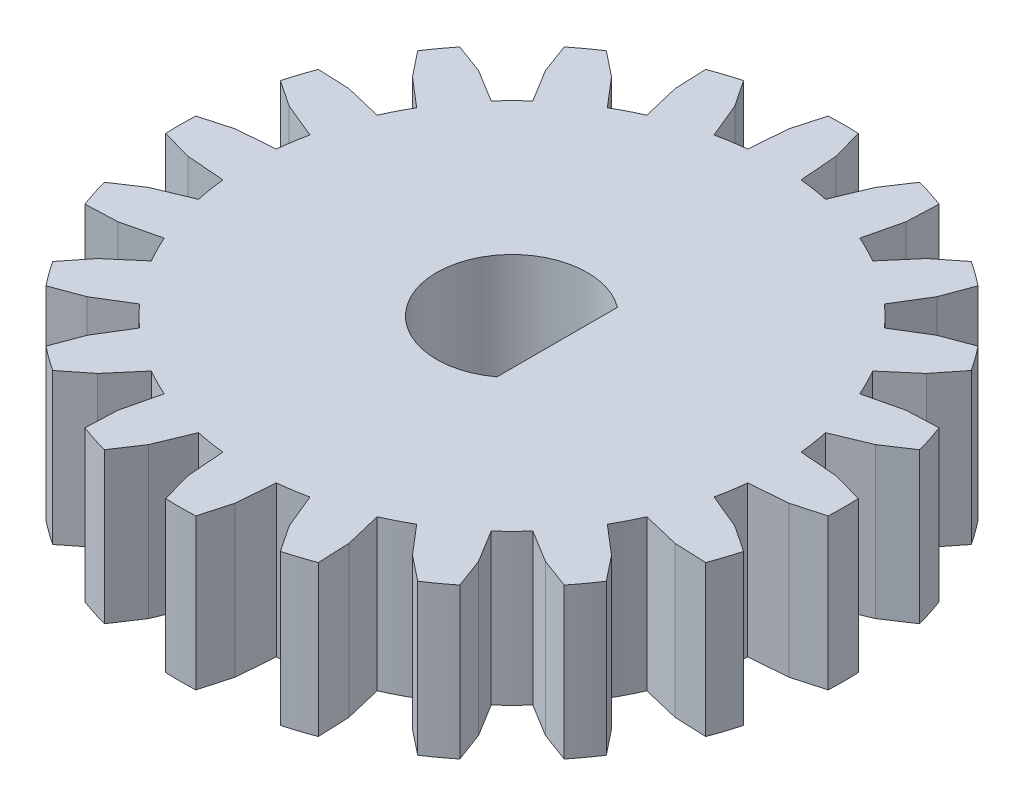
from build123d import *

# Parameters (mm, degrees)
BOSS_EXTRUDE1_DEPTH = 5


with BuildPart() as part:
    # Sketch1 → Boss-Extrude1 (new body)
    with BuildSketch(Plane(origin=(0, 0, 0), x_dir=(1, 0, 0), z_dir=(0, 1, 0))):
        with BuildLine():
            Line((0.885, 8.705129235), (0.785, 9.969141137))
            Line((0.785, 9.969141137), (0.5, 10.988630488))
            ThreePointArc((0.5, 10.988630488), (0, 11), (-0.5, 10.988630488))
            Line((-0.5, 10.988630488), (-0.785, 9.969141137))
            Line((-0.785, 9.969141137), (-0.885, 8.705129235))
            ThreePointArc((-0.885, 8.705129235), (-1.368801569, 8.64227298), (-1.848347855, 8.552549924))
            Line((-1.848347855, 8.552549924), (-2.334054665, 9.72379498))
            Line((-2.334054665, 9.72379498), (-2.920145308, 10.605317128))
            ThreePointArc((-2.920145308, 10.605317128), (-3.399186938, 10.461621679), (-3.871201824, 10.296300134))
            Line((-3.871201824, 10.296300134), (-3.827213396, 9.238638299))
            Line((-3.827213396, 9.238638299), (-3.531717889, 8.005589844))
            ThreePointArc((-3.531717889, 8.005589844), (-3.972416873, 7.796307087), (-4.400766544, 7.562787438))
            Line((-4.400766544, 7.562787438), (-5.224635797, 8.526616022))
            Line((-5.224635797, 8.526616022), (-6.054446447, 9.183881436))
            ThreePointArc((-6.054446447, 9.183881436), (-6.465637775, 8.899186938), (-6.863463441, 8.596096183))
            Line((-6.863463441, 8.596096183), (-6.494792479, 7.603793176))
            Line((-6.494792479, 7.603793176), (-5.832726624, 6.522407541))
            ThreePointArc((-5.832726624, 6.522407541), (-6.187184335, 6.187184335), (-6.522407541, 5.832726624))
            Line((-6.522407541, 5.832726624), (-7.603793176, 6.494792479))
            Line((-7.603793176, 6.494792479), (-8.596096183, 6.863463441))
            ThreePointArc((-8.596096183, 6.863463441), (-8.899186938, 6.465637775), (-9.183881436, 6.054446447))
            Line((-9.183881436, 6.054446447), (-8.526616022, 5.224635797))
            Line((-8.526616022, 5.224635797), (-7.562787438, 4.400766544))
            ThreePointArc((-7.562787438, 4.400766544), (-7.796307087, 3.972416873), (-8.005589844, 3.531717889))
            Line((-8.005589844, 3.531717889), (-9.238638299, 3.827213396))
            Line((-9.238638299, 3.827213396), (-10.296300134, 3.871201824))
            ThreePointArc((-10.296300134, 3.871201824), (-10.461621679, 3.399186938), (-10.605317128, 2.920145308))
            Line((-10.605317128, 2.920145308), (-9.72379498, 2.334054665))
            Line((-9.72379498, 2.334054665), (-8.552549924, 1.848347855))
            ThreePointArc((-8.552549924, 1.848347855), (-8.64227298, 1.368801569), (-8.705129235, 0.885))
            Line((-8.705129235, 0.885), (-9.969141137, 0.785))
            Line((-9.969141137, 0.785), (-10.988630488, 0.5))
            ThreePointArc((-10.988630488, 0.5), (-11, 0), (-10.988630488, -0.5))
            Line((-10.988630488, -0.5), (-9.969141137, -0.785))
            Line((-9.969141137, -0.785), (-8.705129235, -0.885))
            ThreePointArc((-8.705129235, -0.885), (-8.64227298, -1.368801569), (-8.552549924, -1.848347855))
            Line((-8.552549924, -1.848347855), (-9.72379498, -2.334054665))
            Line((-9.72379498, -2.334054665), (-10.605317128, -2.920145308))
            ThreePointArc((-10.605317128, -2.920145308), (-10.461621679, -3.399186938), (-10.296300134, -3.871201824))
            Line((-10.296300134, -3.871201824), (-9.238638299, -3.827213396))
            Line((-9.238638299, -3.827213396), (-8.005589844, -3.531717889))
            ThreePointArc((-8.005589844, -3.531717889), (-7.796307087, -3.972416873), (-7.562787438, -4.400766544))
            Line((-7.562787438, -4.400766544), (-8.526616022, -5.224635797))
            Line((-8.526616022, -5.224635797), (-9.183881436, -6.054446447))
            ThreePointArc((-9.183881436, -6.054446447), (-8.899186938, -6.465637775), (-8.596096183, -6.863463441))
            Line((-8.596096183, -6.863463441), (-7.603793176, -6.494792479))
            Line((-7.603793176, -6.494792479), (-6.522407541, -5.832726624))
            ThreePointArc((-6.522407541, -5.832726624), (-6.187184335, -6.187184335), (-5.832726624, -6.522407541))
            Line((-5.832726624, -6.522407541), (-6.494792479, -7.603793176))
            Line((-6.494792479, -7.603793176), (-6.863463441, -8.596096183))
            ThreePointArc((-6.863463441, -8.596096183), (-6.465637775, -8.899186938), (-6.054446447, -9.183881436))
            Line((-6.054446447, -9.183881436), (-5.224635797, -8.526616022))
            Line((-5.224635797, -8.526616022), (-4.400766544, -7.562787438))
            ThreePointArc((-4.400766544, -7.562787438), (-3.972416873, -7.796307087), (-3.531717889, -8.005589844))
            Line((-3.531717889, -8.005589844), (-3.827213396, -9.238638299))
            Line((-3.827213396, -9.238638299), (-3.871201824, -10.296300134))
            ThreePointArc((-3.871201824, -10.296300134), (-3.399186938, -10.461621679), (-2.920145308, -10.605317128))
            Line((-2.920145308, -10.605317128), (-2.334054665, -9.72379498))
            Line((-2.334054665, -9.72379498), (-1.848347855, -8.552549924))
            ThreePointArc((-1.848347855, -8.552549924), (-1.368801569, -8.64227298), (-0.885, -8.705129235))
            Line((-0.885, -8.705129235), (-0.785, -9.969141137))
            Line((-0.785, -9.969141137), (-0.5, -10.988630488))
            ThreePointArc((-0.5, -10.988630488), (0, -11), (0.5, -10.988630488))
            Line((0.5, -10.988630488), (0.785, -9.969141137))
            Line((0.785, -9.969141137), (0.885, -8.705129235))
            ThreePointArc((0.885, -8.705129235), (1.368801569, -8.64227298), (1.848347855, -8.552549924))
            Line((1.848347855, -8.552549924), (2.334054665, -9.72379498))
            Line((2.334054665, -9.72379498), (2.920145308, -10.605317128))
            ThreePointArc((2.920145308, -10.605317128), (3.399186938, -10.461621679), (3.871201824, -10.296300134))
            Line((3.871201824, -10.296300134), (3.827213396, -9.238638299))
            Line((3.827213396, -9.238638299), (3.531717889, -8.005589844))
            ThreePointArc((3.531717889, -8.005589844), (3.972416873, -7.796307087), (4.400766544, -7.562787438))
            Line((4.400766544, -7.562787438), (5.224635797, -8.526616022))
            Line((5.224635797, -8.526616022), (6.054446447, -9.183881436))
            ThreePointArc((6.054446447, -9.183881436), (6.465637775, -8.899186938), (6.863463441, -8.596096183))
            Line((6.863463441, -8.596096183), (6.494792479, -7.603793176))
            Line((6.494792479, -7.603793176), (5.832726624, -6.522407541))
            ThreePointArc((5.832726624, -6.522407541), (6.187184335, -6.187184335), (6.522407541, -5.832726624))
            Line((6.522407541, -5.832726624), (7.603793176, -6.494792479))
            Line((7.603793176, -6.494792479), (8.596096183, -6.863463441))
            ThreePointArc((8.596096183, -6.863463441), (8.899186938, -6.465637775), (9.183881436, -6.054446447))
            Line((9.183881436, -6.054446447), (8.526616022, -5.224635797))
            Line((8.526616022, -5.224635797), (7.562787438, -4.400766544))
            ThreePointArc((7.562787438, -4.400766544), (7.796307087, -3.972416873), (8.005589844, -3.531717889))
            Line((8.005589844, -3.531717889), (9.238638299, -3.827213396))
            Line((9.238638299, -3.827213396), (10.296300134, -3.871201824))
            ThreePointArc((10.296300134, -3.871201824), (10.461621679, -3.399186938), (10.605317128, -2.920145308))
            Line((10.605317128, -2.920145308), (9.72379498, -2.334054665))
            Line((9.72379498, -2.334054665), (8.552549924, -1.848347855))
            ThreePointArc((8.552549924, -1.848347855), (8.64227298, -1.368801569), (8.705129235, -0.885))
            Line((8.705129235, -0.885), (9.969141137, -0.785))
            Line((9.969141137, -0.785), (10.988630488, -0.5))
            ThreePointArc((10.988630488, -0.5), (11, 0), (10.988630488, 0.5))
            Line((10.988630488, 0.5), (9.969141137, 0.785))
            Line((9.969141137, 0.785), (8.705129235, 0.885))
            ThreePointArc((8.705129235, 0.885), (8.64227298, 1.368801569), (8.552549924, 1.848347855))
            Line((8.552549924, 1.848347855), (9.72379498, 2.334054665))
            Line((9.72379498, 2.334054665), (10.605317128, 2.920145308))
            ThreePointArc((10.605317128, 2.920145308), (10.461621679, 3.399186938), (10.296300134, 3.871201824))
            Line((10.296300134, 3.871201824), (9.238638299, 3.827213396))
            Line((9.238638299, 3.827213396), (8.005589844, 3.531717889))
            ThreePointArc((8.005589844, 3.531717889), (7.796307087, 3.972416873), (7.562787438, 4.400766544))
            Line((7.562787438, 4.400766544), (8.526616022, 5.224635797))
            Line((8.526616022, 5.224635797), (9.183881436, 6.054446447))
            ThreePointArc((9.183881436, 6.054446447), (8.899186938, 6.465637775), (8.596096183, 6.863463441))
            Line((8.596096183, 6.863463441), (7.603793176, 6.494792479))
            Line((7.603793176, 6.494792479), (6.522407541, 5.832726624))
            ThreePointArc((6.522407541, 5.832726624), (6.187184335, 6.187184335), (5.832726624, 6.522407541))
            Line((5.832726624, 6.522407541), (6.494792479, 7.603793176))
            Line((6.494792479, 7.603793176), (6.863463441, 8.596096183))
            ThreePointArc((6.863463441, 8.596096183), (6.465637775, 8.899186938), (6.054446447, 9.183881436))
            Line((6.054446447, 9.183881436), (5.224635797, 8.526616022))
            Line((5.224635797, 8.526616022), (4.400766544, 7.562787438))
            ThreePointArc((4.400766544, 7.562787438), (3.972416873, 7.796307087), (3.531717889, 8.005589844))
            Line((3.531717889, 8.005589844), (3.827213396, 9.238638299))
            Line((3.827213396, 9.238638299), (3.871201824, 10.296300134))
            ThreePointArc((3.871201824, 10.296300134), (3.399186938, 10.461621679), (2.920145308, 10.605317128))
            Line((2.920145308, 10.605317128), (2.334054665, 9.72379498))
            Line((2.334054665, 9.72379498), (1.848347855, 8.552549924))
            ThreePointArc((1.848347855, 8.552549924), (1.368801569, 8.64227298), (0.885, 8.705129235))
        make_face()
        with BuildLine():
            Line((1.5, 2), (1.5, -2))
            ThreePointArc((1.5, -2), (-2.5, 0), (1.5, 2))
        make_face(mode=Mode.SUBTRACT)
    extrude(amount=BOSS_EXTRUDE1_DEPTH)


solid = part.part
